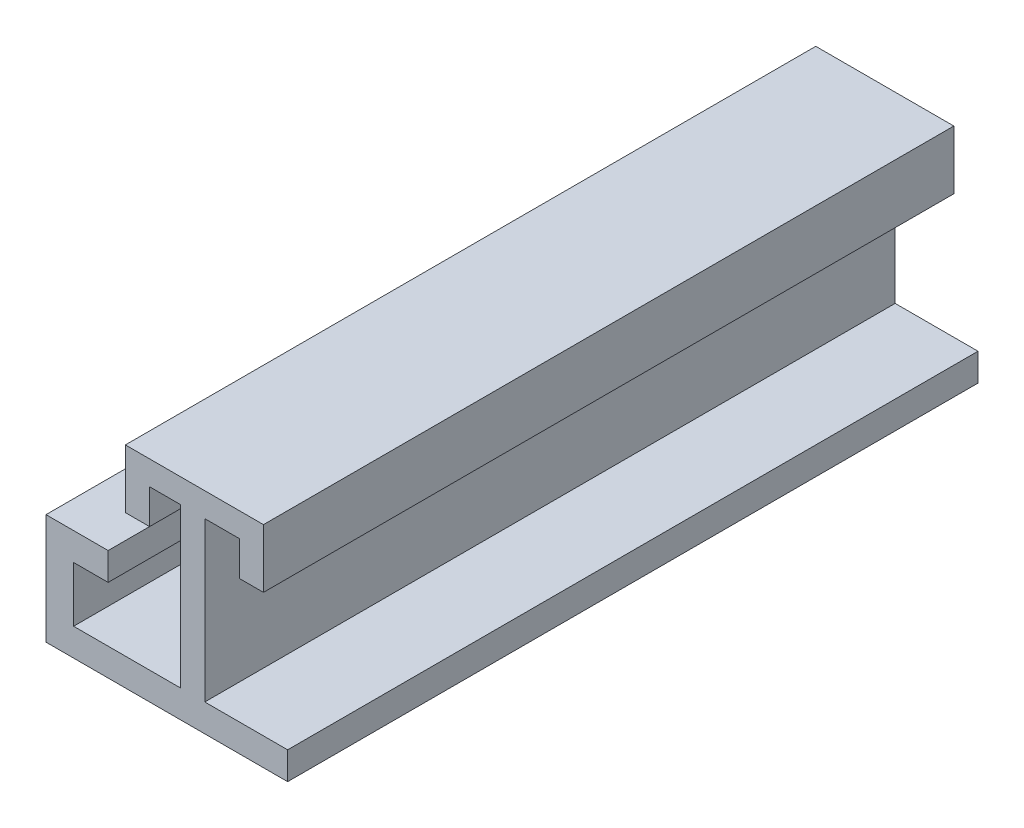
from build123d import *

# Parameters (mm, degrees)
SKETCH_1_W          = 3
SKETCH_1_H          = 46
SKETCH_1_W_2        = 4
SKETCH_1_H_2        = 4
EXTRUDE_1_DEPTH     = 100
SKETCH_2_W          = 8
SKETCH_2_H          = 8
CUT_EXTRUDE_1_DEPTH = 212.324395184


with BuildPart() as part:
    # Эскиз1 → Бобышка-Вытянуть1 (new, symmetric)
    with BuildSketch(Plane.XY):
        with Locations((1.5, 23)):
            Rectangle(SKETCH_1_W, SKETCH_1_H)
        with Locations((-2, 23)):
            Rectangle(SKETCH_1_W_2, SKETCH_1_H)
        Polygon((-4, 50), (0, 50), (3, 50), (17, 50), (17, 36), (20, 36), (20, 53), (0, 53), (-20, 53), (-20, 36), (-17, 36), (-17, 50), align=None)
        with Locations((-2, 48)):
            Rectangle(SKETCH_1_W_2, SKETCH_1_H_2)
        Polygon((-13, 46), (-4, 46), (-4, 50), (-17, 50), (-17, 36), (-13, 36), align=None)
        Polygon((3, 50), (3, 46), (13, 46), (13, 36), (17, 36), (17, 50), align=None)
        with Locations((1.5, 48)):
            Rectangle(SKETCH_1_W, SKETCH_1_H_2)
        Polygon((3, 0), (0, 0), (-4, 0), (-35, 0), (-35, 16), (-25, 16), (-25, 20), (-39, 20), (-39, -4), (35, -4), (35, 0), align=None)
        Polygon((35, -8), (35, -4), (-39, -4), (-39, 20), (-25, 20), (-25, 24), (-43, 24), (-43, -8), align=None)
    extrude(amount=EXTRUDE_1_DEPTH, both=True)

    # Эскиз2 → Вырез-Вытянуть1 (cut, through all)
    with BuildSketch(Plane.XY.offset(100)):
        with Locations((31, -4)):
            Rectangle(SKETCH_2_W, SKETCH_2_H)
    extrude(amount=-CUT_EXTRUDE_1_DEPTH, mode=Mode.SUBTRACT)


solid = part.part
